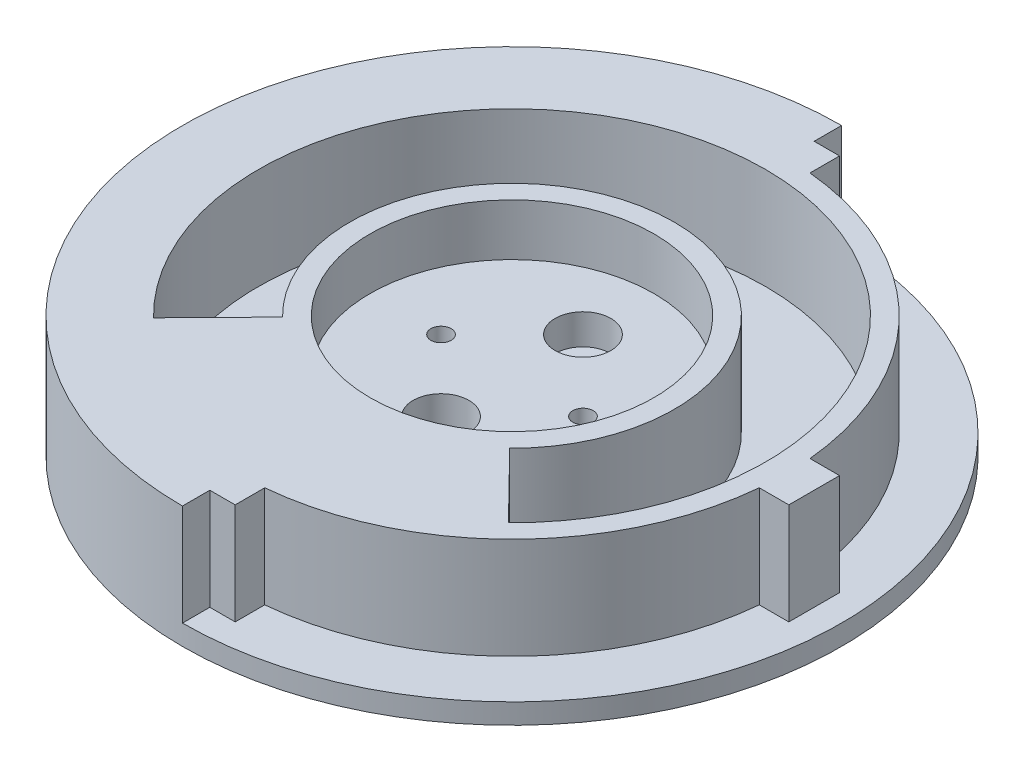
from build123d import *

# Parameters (mm, degrees)
SKETCH1_R               = 27
SKETCH1_R_2             = 14
BOSS_EXTRUDE1_DEPTH     = 10
SKETCH2_R               = 32.5
BOSS_EXTRUDE2_DEPTH     = 2
SKETCH3_W               = 5
SKETCH3_H               = 4.39677325
SKETCH3_W_2             = 4.39677325
SKETCH3_H_2             = 5
BOSS_EXTRUDE3_DEPTH     = 10
BOSS_EXTRUDE4_DEPTH     = 10
BOSS_EXTRUDE5_START     = -4.9
SKETCH6_R               = 14
BOSS_EXTRUDE5_DEPTH     = 4.9
CUT_EXTRUDE1_DEPTH      = 48.502631506
CUT_EXTRUDE1_DEPTH_BACK = 48.502631506
SKETCH4_R               = 1
SKETCH10_R              = 2.75
CUT_EXTRUDE4_DEPTH      = 3
SKETCH11_R              = 4
CUT_EXTRUDE5_DEPTH      = 1


with BuildPart() as part:
    # Sketch1 → Boss-Extrude1 (new body)
    with BuildSketch(Plane(origin=(0, 0, 0), x_dir=(1, 0, 0), z_dir=(0, 1, 0))):
        with Locations(Location((0, 0, 0), (0, 0, 270))):
            Circle(SKETCH1_R)
        with Locations(Location((0, 0, 0), (0, 0, 270))):
            Circle(SKETCH1_R_2, mode=Mode.SUBTRACT)
        with BuildLine():
            Line((-17.5, -17.853571071), (-11.2, -11.426285486))
            ThreePointArc((-11.2, -11.426285486), (0, 16), (11.2, -11.426285486))
            Line((11.2, -11.426285486), (17.5, -17.853571071))
            ThreePointArc((17.5, -17.853571071), (0, 25), (-17.5, -17.853571071))
        make_face(mode=Mode.SUBTRACT)
    extrude(amount=BOSS_EXTRUDE1_DEPTH)

    # Sketch2 → Boss-Extrude2 (add)
    with BuildSketch(Plane.XZ):
        with Locations(Location((0, 0, 0), (0, 0, 270))):
            Circle(SKETCH2_R)
    extrude(amount=BOSS_EXTRUDE2_DEPTH)

    # Sketch3 → Boss-Extrude3 (add)
    with BuildSketch(Plane(origin=(0, 0, 0), x_dir=(1, 0, 0), z_dir=(0, 1, 0))):
        with Locations((0, 27.601613375)):
            Rectangle(SKETCH3_W, SKETCH3_H)
        with Locations((27.601613375, 0)):
            Rectangle(SKETCH3_W_2, SKETCH3_H_2)
        with Locations((0, -27.601613375)):
            Rectangle(SKETCH3_W, SKETCH3_H)
        with Locations((-27.601613375, 0)):
            Rectangle(SKETCH3_W_2, SKETCH3_H_2)
    extrude(amount=BOSS_EXTRUDE3_DEPTH)

    # Sketch5 → Boss-Extrude4 (add)
    with BuildSketch(Plane(origin=(0, 0, 0), x_dir=(1, 0, 0), z_dir=(0, 1, 0))):
        with BuildLine():
            Line((0, 29.8), (0, 32.5))
            ThreePointArc((0, 32.5), (-32.5, 0), (0, -32.5))
            Line((0, -32.5), (0, -29.8))
            Line((0, -29.8), (-2.5, -29.8))
            Line((-2.5, -29.8), (-2.5, -26.884010118))
            ThreePointArc((-2.5, -26.884010118), (-19.091883092, -19.091883092), (-26.884010118, -2.5))
            Line((-26.884010118, -2.5), (-29.8, -2.5))
            Line((-29.8, -2.5), (-29.8, 2.5))
            Line((-29.8, 2.5), (-26.884010118, 2.5))
            ThreePointArc((-26.884010118, 2.5), (-19.091883092, 19.091883092), (-2.5, 26.884010118))
            Line((-2.5, 26.884010118), (-2.5, 29.8))
            Line((-2.5, 29.8), (0, 29.8))
        make_face()
    extrude(amount=BOSS_EXTRUDE4_DEPTH)

    # Sketch6 → Boss-Extrude5 (add)
    with BuildSketch(Plane(origin=(0, 4.9, 0), x_dir=(1, 0, 0), z_dir=(0, 1, 0)).offset(BOSS_EXTRUDE5_START)):
        with Locations(Location((0, 0, 0), (0, 0, 270))):
            Circle(SKETCH6_R)
    extrude(amount=BOSS_EXTRUDE5_DEPTH)

    # Sketch4 → Cut-Extrude1 (cut, two sides: drawn at the far end of the back side and taken through both)
    with BuildSketch(Plane.XZ.offset(2).offset(-CUT_EXTRUDE1_DEPTH_BACK)):
        with Locations(Location((0, -7, 0), (0, 0, 270))):
            Circle(SKETCH4_R)
        with Locations(Location((-7, 0, 0), (0, 0, 270))):
            Circle(SKETCH4_R)
        with Locations(Location((0, 7, 0), (0, 0, 270))):
            Circle(SKETCH4_R)
        with Locations(Location((7, 0, 0), (0, 0, 270))):
            Circle(SKETCH4_R)
    extrude(amount=CUT_EXTRUDE1_DEPTH + CUT_EXTRUDE1_DEPTH_BACK, mode=Mode.SUBTRACT)

    # Sketch10 → Cut-Extrude4 (cut)
    with BuildSketch(Plane(origin=(0, 4.9, 0), x_dir=(1, 0, 0), z_dir=(0, 1, 0))):
        with Locations(Location((0, 7, 0), (0, 0, 270))):
            Circle(SKETCH10_R)
        with Locations(Location((0, -7, 0), (0, 0, 270))):
            Circle(SKETCH10_R)
    extrude(amount=-CUT_EXTRUDE4_DEPTH, mode=Mode.SUBTRACT)

    # Sketch11 → Cut-Extrude5 (cut)
    with BuildSketch(Plane.XZ.offset(2)):
        with Locations(Location((0, 0, 0), (0, 0, 270))):
            Circle(SKETCH11_R)
    extrude(amount=-CUT_EXTRUDE5_DEPTH, mode=Mode.SUBTRACT)


solid = part.part
